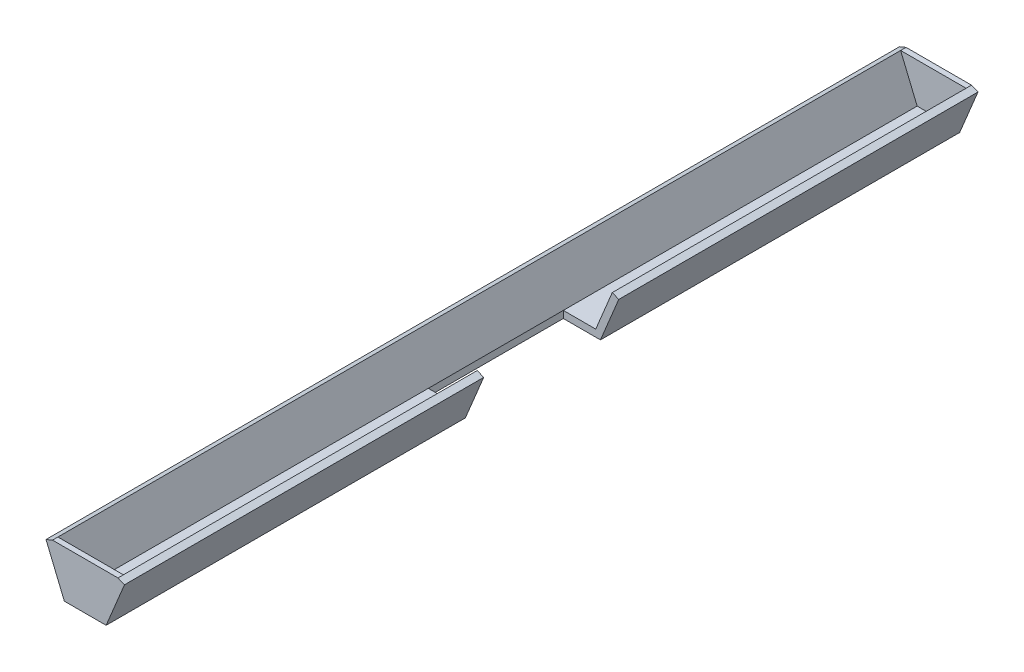
from build123d import *

# Parameters (mm, degrees)
RESSALTO_EXTRUS_O1_DEPTH = 79
RESSALTO_EXTRUS_O2_DEPTH = 1
ESBO_O4_W                = 23.972124634
ESBO_O4_H                = 25
CORTE_EXTRUS_O1_DEPTH    = 80.807757613


with BuildPart() as part:
    # Esboço1 → Ressalto-extrusão1 (new, symmetric)
    with BuildSketch(Plane.XY):
        Polygon((-3, 0), (3, 0), (6.061467459, 7.39103626), (7.262510851, 6.893547798), (3.868632229, -1.3), (-3.868632229, -1.3), (-7.262510851, 6.893547798), (-6.061467459, 7.39103626), align=None)
    extrude(amount=RESSALTO_EXTRUS_O1_DEPTH, both=True)

    # Esboço2 → Ressalto-extrusão2 (add)
    with BuildSketch(Plane(origin=(0, 0, -79), x_dir=(-1, 0, 0), z_dir=(0, 0, -1))):
        Polygon((-6.061467459, 7.39103626), (6.061467459, 7.39103626), (7.262510851, 6.893547798), (3.868632229, -1.3), (-3.868632229, -1.3), (-7.262510851, 6.893547798), align=None)
    ressalto_extrus_o2 = extrude(amount=-RESSALTO_EXTRUS_O2_DEPTH)

    # Espelhar1: Ressalto-extrusão2 across plane
    add(ressalto_extrus_o2.mirror(Plane.XY))

    # Esboço4 → Corte-extrusão1 (cut, through all)
    with BuildSketch(Plane.XZ.offset(1.3)):
        with Locations((8.986062317, 0)):
            Rectangle(ESBO_O4_W, ESBO_O4_H)
    extrude(amount=-CORTE_EXTRUS_O1_DEPTH, mode=Mode.SUBTRACT)


solid = part.part
